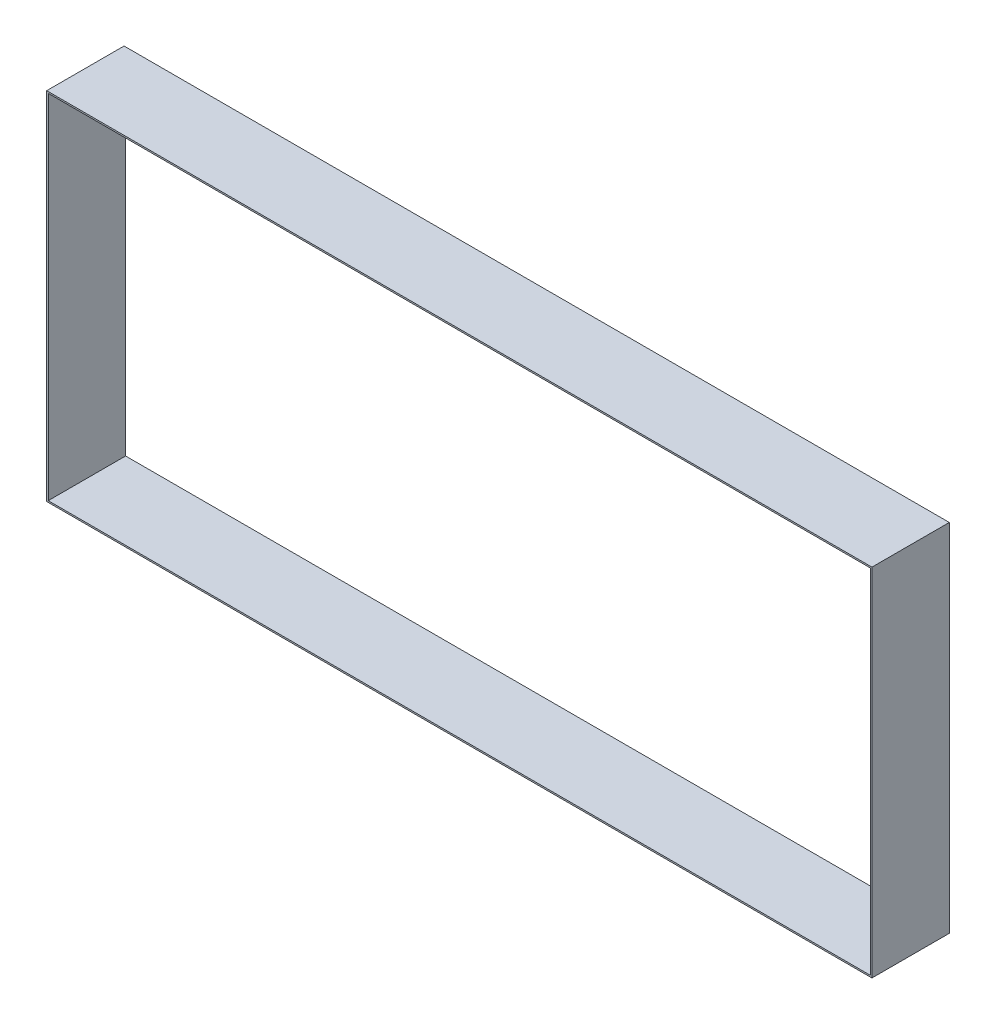
from build123d import *

# Parameters (mm, degrees)
SKETCH1_W           = 533.4
SKETCH1_H           = 230
SKETCH1_W_2         = 531.4
SKETCH1_H_2         = 228
BOSS_EXTRUDE1_DEPTH = 50


with BuildPart() as part:
    # Sketch1 → Boss-Extrude1 (new body)
    with BuildSketch(Plane.XY):
        with Locations((208.831597967, -83.858800774)):
            Rectangle(SKETCH1_W, SKETCH1_H)
        with Locations((208.831597967, -83.858800774)):
            Rectangle(SKETCH1_W_2, SKETCH1_H_2, mode=Mode.SUBTRACT)
    extrude(amount=BOSS_EXTRUDE1_DEPTH)


solid = part.part
